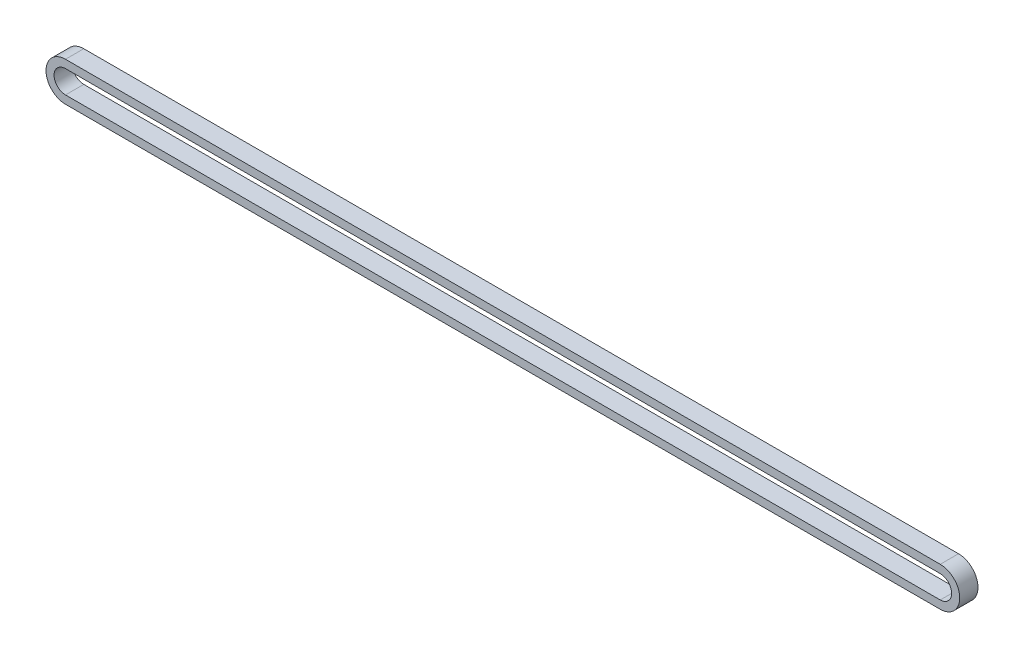
from build123d import *

# Parameters (mm, degrees)
BOSS_EXTRUDE1_DEPTH = 3


with BuildPart() as part:
    # Sketch2 → Boss-Extrude1 (new body)
    with BuildSketch(Plane.XY):
        with BuildLine():
            Line((0, 3.2), (143.6, 3.2))
            ThreePointArc((143.6, 3.2), (146.8, 0), (143.6, -3.2))
            Line((143.6, -3.2), (0, -3.2))
            ThreePointArc((0, -3.2), (-3.2, 0), (0, 3.2))
        make_face()
        with BuildLine():
            Line((0, 1.872), (143.6, 1.872))
            ThreePointArc((143.6, 1.872), (145.472, 0), (143.6, -1.872))
            Line((143.6, -1.872), (0, -1.872))
            ThreePointArc((0, -1.872), (-1.872, 0), (0, 1.872))
        make_face(mode=Mode.SUBTRACT)
    extrude(amount=-BOSS_EXTRUDE1_DEPTH)


solid = part.part
